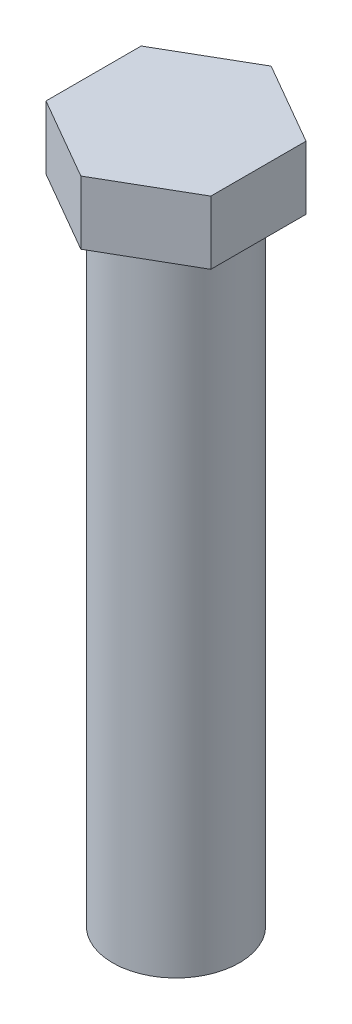
from build123d import *

# Parameters (mm, degrees)
SKETCH2_W           = 5
SKETCH2_H           = 50
BOSS_EXTRUDE1_DEPTH = 5


with BuildPart() as part:
    # Sketch2 → Revolve1 (revolve)
    with BuildSketch(Plane.XY, mode=Mode.PRIVATE) as revolve1_sk:
        with Locations((-2.5, 0)):
            Rectangle(SKETCH2_W, SKETCH2_H)
    revolve(revolve1_sk.sketch.rotate(Axis((0, 59.523809524, 0), (0, -1, 0)), 270), axis=Axis((0, 59.523809524, 0), (0, -1, 0)))

    # Sketch3 → Boss-Extrude1 (add)
    with BuildSketch(Plane(origin=(0, 25, 0), x_dir=(1, 0, 0), z_dir=(0, 1, 0))):
        Polygon((-6.5, 3.75277675), (-6.5, -3.75277675), (0, -7.505553499), (6.5, -3.75277675), (6.5, 3.75277675), (0, 7.505553499), align=None)
    extrude(amount=BOSS_EXTRUDE1_DEPTH)


solid = part.part
